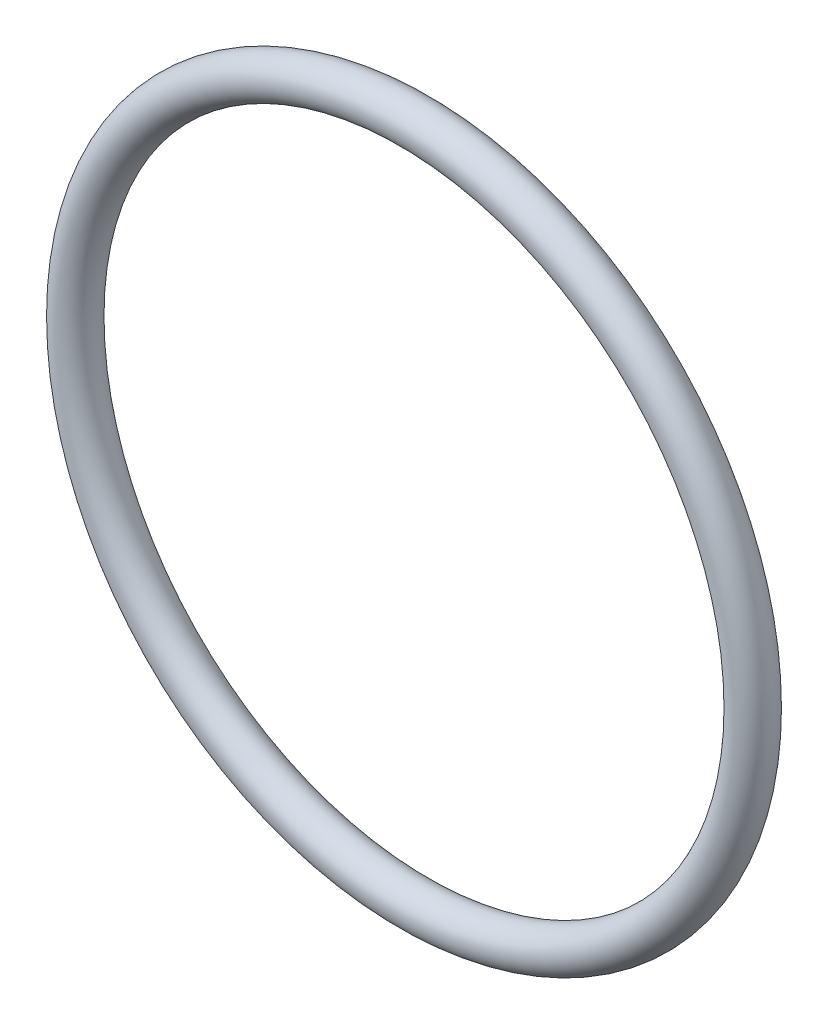
from build123d import *

# Parameters (mm, degrees)
SKETCH2_R = 1.5


with BuildPart() as part:
    # Sweep1: sweep along a path in Sketch1
    with BuildLine(Plane.XY) as sweep1_path:
        CenterArc((0, 0), 25, 0, 360)
    # Sketch2 → Sweep1 (sweep)
    with BuildSketch(Plane(origin=(0, 0, 0), x_dir=(1, 0, 0), z_dir=(0, 1, 0))):
        with Locations((-25, 0)):
            Circle(SKETCH2_R)
    sweep(path=sweep1_path.line)


solid = part.part
